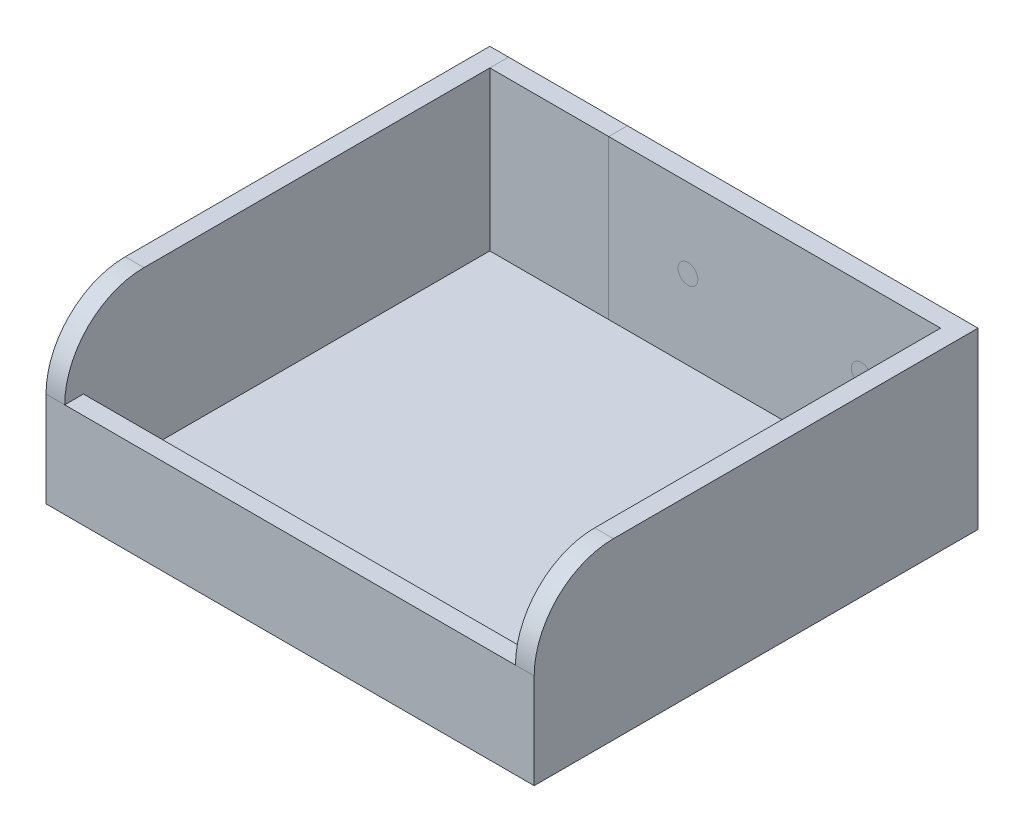
from build123d import *

# Parameters (mm, degrees)
SKETCH1_W             = 72.232
SKETCH1_H             = 65.12
BOSS_EXTRUDE1_DEPTH   = 2.54
BOSS_EXTRUDE2_DEPTH   = 27.94
SKETCH1_4_W           = 19.05
SKETCH1_4_H           = 3
BOSS_EXTRUDE3_DEPTH   = 27.94
SKETCH2_W             = 72.232
SKETCH2_H             = 12.7
CUT_EXTRUDE1_DEPTH    = 27.94
FILLET1_R             = 12.7
SKETCH3_R             = 1.5875
CUT_EXTRUDE2_DEPTH    = 3
SKETCH3_2_R           = 1.5875
BOSS_EXTRUDE4_DEPTH   = 3
BOSS_EXTRUDE4_2_DEPTH = 3


with BuildPart() as part:
    # Sketch1 → Boss-Extrude1 (new body)
    with BuildSketch(Plane(origin=(0, 0, 0), x_dir=(1, 0, 0), z_dir=(0, 1, 0))):
        Rectangle(SKETCH1_W, SKETCH1_H)
    extrude(amount=BOSS_EXTRUDE1_DEPTH)

    # Sketch1<3> → Boss-Extrude2 (add)
    with BuildSketch(Plane(origin=(0, 0, 0), x_dir=(1, 0, 0), z_dir=(0, 1, 0))):
        Polygon((-36.116, -32.56), (-36.116, 32.56), (-36.116, 35.56), (-39.116, 35.56), (-39.116, -35.56), (39.116, -35.56), (39.116, 35.56), (-17.066, 35.56), (-17.066, 32.56), (36.116, 32.56), (36.116, -32.56), align=None)
    extrude(amount=BOSS_EXTRUDE2_DEPTH)

    # Sketch2 → Cut-Extrude1 (cut)
    with BuildSketch(Plane.XY.offset(35.56)):
        with Locations((0, 21.59)):
            Rectangle(SKETCH2_W, SKETCH2_H)
    extrude(amount=-CUT_EXTRUDE1_DEPTH, mode=Mode.SUBTRACT)

    # Fillet1
    fillet1_edges = [part.edges().sort_by_distance(p)[0] for p in [
        (-37.616, 27.94, 35.56),
        (37.616, 27.94, 35.56),
    ]]
    fillet(fillet1_edges, radius=FILLET1_R)

    # Sketch3 → Cut-Extrude2 (cut)
    with BuildSketch(Plane.XY.offset(-32.56)):
        with Locations((23.416, 15.24)):
            Circle(SKETCH3_R)
        with Locations((-4.366, 15.24)):
            Circle(SKETCH3_R)
    extrude(amount=-CUT_EXTRUDE2_DEPTH, mode=Mode.SUBTRACT)


with BuildPart() as body_2:
    # Sketch1<4> → Boss-Extrude3 (new body)
    with BuildSketch(Plane(origin=(0, 0, 0), x_dir=(1, 0, 0), z_dir=(0, 1, 0))):
        with Locations((-26.591, 34.06)):
            Rectangle(SKETCH1_4_W, SKETCH1_4_H)
    extrude(amount=BOSS_EXTRUDE3_DEPTH)


with BuildPart() as body_3:
    # Sketch3<2> → Boss-Extrude4 (new body)
    with BuildSketch(Plane.XY.offset(-32.56)):
        with Locations((23.416, 15.24)):
            Circle(SKETCH3_2_R)
    extrude(amount=-BOSS_EXTRUDE4_DEPTH)


with BuildPart() as body_4:
    # Sketch3<2> → Boss-Extrude4 2 (new body)
    with BuildSketch(Plane.XY.offset(-32.56)):
        with Locations((-4.366, 15.24)):
            Circle(SKETCH3_2_R)
    extrude(amount=-BOSS_EXTRUDE4_2_DEPTH)


solid = Compound([part.part, body_2.part, body_3.part, body_4.part])
